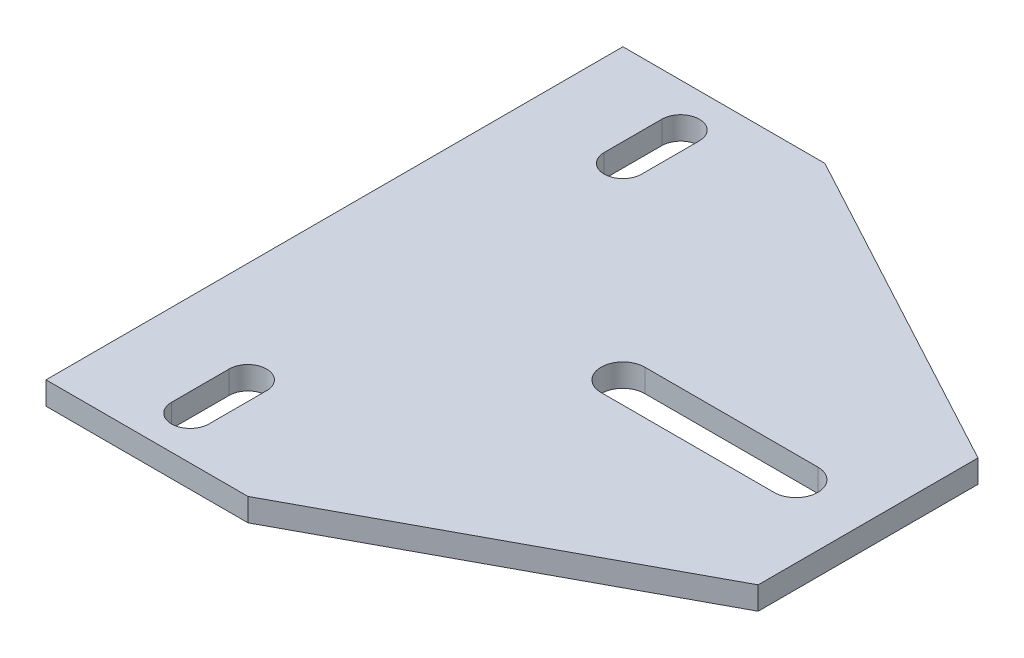
from build123d import *

# Parameters (mm, degrees)
SALIENTE_EXTRUIR1_DEPTH = 7.9375


with BuildPart() as part:
    # Croquis1 → Saliente-Extruir1 (new body)
    with BuildSketch(Plane(origin=(0, 0, 0), x_dir=(1, 0, 0), z_dir=(0, 1, 0))):
        Polygon((70, -100), (0, -100), (0, 100), (70, 100), (185, 38.1), (185, -38.1), align=None)
        with BuildLine():
            ThreePointArc((41.5, -65), (35, -58.5), (28.5, -65))
            Line((28.5, -65), (28.5, -85))
            ThreePointArc((28.5, -85), (35, -91.5), (41.5, -85))
            Line((41.5, -85), (41.5, -65))
        make_face(mode=Mode.SUBTRACT)
        with BuildLine():
            ThreePointArc((160, -7.597922996), (167.597922996, 0), (160, 7.597922996))
            Line((160, 7.597922996), (100, 7.597922996))
            ThreePointArc((100, 7.597922996), (92.402077004, 0), (100, -7.597922996))
            Line((100, -7.597922996), (160, -7.597922996))
        make_face(mode=Mode.SUBTRACT)
        with BuildLine():
            Line((41.5, 85), (41.5, 65))
            ThreePointArc((41.5, 65), (35, 58.5), (28.5, 65))
            Line((28.5, 65), (28.5, 85))
            ThreePointArc((28.5, 85), (35, 91.5), (41.5, 85))
        make_face(mode=Mode.SUBTRACT)
    extrude(amount=SALIENTE_EXTRUIR1_DEPTH)


solid = part.part
